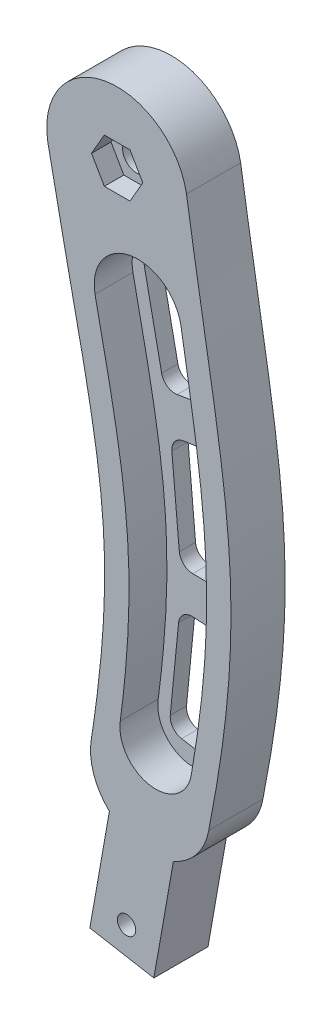
from build123d import *

# Parameters (mm, degrees)
SKETCH1_R           = 2.6
BOSS_EXTRUDE1_DEPTH = 10
SKETCH2_R           = 1.7
BOSS_EXTRUDE2_DEPTH = 10
CUT_EXTRUDE1_DEPTH  = 3.61
CUT_EXTRUDE2_DEPTH  = 7.01


with BuildPart() as part:
    # Sketch1 → Boss-Extrude1 (new body)
    with BuildSketch(Plane.XY.offset(348)):
        with BuildLine():
            ThreePointArc((295.244800935, 76.37840131), (304.167556264, 63.635386072), (316.910571501, 72.558141401))
            add(Edge.make_bspline(
                [(316.910571501, 72.558141401), (317.993077182, 78.060080938), (319.436691833, 86.419493367), (320.644104939, 97.746663028), (321.086020795, 106.446056452), (320.974468629, 115.188631518), (320.331239752, 123.834659135), (319.294204188, 132.281931409), (318.037316746, 140.511779077), (316.695476199, 148.568110679), (314.90656957, 159.124453911), (313.612933772, 167.009808068), (312.802500789, 172.25742631)],
                knots=[0, 0, 0, 0, 0.167265195, 0.252809118, 0.339604775, 0.426899602, 0.513395067, 0.598049027, 0.680668932, 0.761679683, 0.84163696, 1, 1, 1, 1], degree=3))
            ThreePointArc((312.802500789, 172.25742631), (297.74257369, 182.802500789), (287.197499211, 167.74257369))
            add(Edge.make_bspline(
                [(287.197499211, 167.74257369), (288.245214147, 162.428752521), (289.885822364, 154.498518205), (292.118297352, 143.988320878), (293.742742512, 136.235372867), (295.2339085, 128.615976653), (296.473470386, 121.13730858), (297.336811691, 113.762401768), (297.738284398, 106.419106942), (297.668798337, 99.033764721), (297.014800417, 88.987730843), (296.022440082, 81.435185794), (295.244800935, 76.37840131)],
                knots=[0, 0, 0, 0, 0.175721332, 0.26273732, 0.348606728, 0.432722922, 0.514619289, 0.594500878, 0.673506544, 0.753057452, 0.833978021, 1, 1, 1, 1], degree=3))
        make_face()
        with Locations((300, 170)):
            Circle(SKETCH1_R, mode=Mode.SUBTRACT)
        with BuildLine():
            Line((298.037273547, 149.741721474), (301.215790437, 134.288941883))
            ThreePointArc((301.215790437, 134.288941883), (302.249879541, 132.731371076), (304.075121449, 132.326575973))
            Line((304.075121449, 132.326575973), (309.533784891, 133.235441013))
            ThreePointArc((309.533784891, 133.235441013), (311.154644108, 134.244376396), (311.590714405, 136.103133481))
            Line((311.590714405, 136.103133481), (309.035810829, 151.799472168))
            ThreePointArc((309.035810829, 151.799472168), (308.002694304, 153.44538336), (306.102883834, 153.854129723))
            Line((306.102883834, 153.854129723), (300.020607078, 152.701705588))
            ThreePointArc((300.020607078, 152.701705588), (298.409129896, 151.6370167), (298.037273547, 149.741721474))
        make_face(mode=Mode.SUBTRACT)
        with BuildLine():
            Line((303.095062376, 122.802641733), (304.478179716, 107.400584875))
            ThreePointArc((304.478179716, 107.400584875), (305.271665108, 105.787912405), (306.941989082, 105.124324138))
            Line((306.941989082, 105.124324138), (311.308057506, 105.078615953))
            ThreePointArc((311.308057506, 105.078615953), (313.134691512, 105.844024349), (313.831371675, 107.697960312))
            Line((313.831371675, 107.697960312), (313.059492575, 123.830124112))
            ThreePointArc((313.059492575, 123.830124112), (312.159795141, 125.633704646), (310.221794191, 126.187338583))
            Line((310.221794191, 126.187338583), (305.244487527, 125.502939826))
            ThreePointArc((305.244487527, 125.502939826), (303.629055674, 124.583200895), (303.095062376, 122.802641733))
        make_face(mode=Mode.SUBTRACT)
        with BuildLine():
            Line((304.341810749, 95.98294616), (302.807326902, 80.41966071))
            ThreePointArc((302.807326902, 80.41966071), (303.310735667, 78.653947907), (304.884570682, 77.708323546))
            Line((304.884570682, 77.708323546), (308.061893299, 77.17917356))
            ThreePointArc((308.061893299, 77.17917356), (309.951832836, 77.629811361), (310.948319998, 79.297731989))
            Line((310.948319998, 79.297731989), (313.173535223, 95.152129395))
            ThreePointArc((313.173535223, 95.152129395), (312.633934067, 97.081184589), (310.85135927, 97.994886096))
            Line((310.85135927, 97.994886096), (306.983305274, 98.232924126))
            ThreePointArc((306.983305274, 98.232924126), (305.208657773, 97.640818137), (304.341810749, 95.98294616))
        make_face(mode=Mode.SUBTRACT)
    extrude(amount=BOSS_EXTRUDE1_DEPTH)

    # Sketch2 → Boss-Extrude2 (add)
    with BuildSketch(Plane.XY.offset(348)):
        Polygon((294.95939437, 45.965927831), (306.777087406, 43.882149699), (311.465588203, 70.47195903), (299.647895167, 72.555737162), align=None)
        with Locations((301.736481777, 49.84807753)):
            Circle(SKETCH2_R, mode=Mode.SUBTRACT)
    extrude(amount=BOSS_EXTRUDE2_DEPTH)

    # Sketch3 → Cut-Extrude1 (cut)
    with BuildSketch(Plane.XY.offset(354.4)):
        Polygon((304.734272207, 170), (302.367136104, 174.1), (297.632863896, 174.1), (295.265727793, 170), (297.632863896, 165.9), (302.367136104, 165.9), align=None)
    extrude(amount=CUT_EXTRUDE1_DEPTH, mode=Mode.SUBTRACT)

    # Sketch4 → Cut-Extrude2 (cut)
    with BuildSketch(Plane.XY.offset(351)):
        with BuildLine():
            ThreePointArc((300.580931265, 81.888864063), (306.130868326, 74.323372231), (313.696360158, 79.873309293))
            add(Edge.make_bspline(
                [(313.696360158, 79.873309293), (314.375332718, 83.768049726), (315.269853801, 89.655581864), (316.076109947, 97.581166828), (316.452007736, 103.60449348), (316.564187736, 109.663923395), (316.399741723, 115.723723037), (315.97594992, 121.744253087), (315.33821911, 127.695568385), (314.545946492, 133.565929662), (313.36456358, 141.260072259), (312.394961182, 146.988748853), (311.75464163, 150.792263987)],
                knots=[0, 0, 0, 0, 0.166088556, 0.250039022, 0.33458405, 0.419536565, 0.504540949, 0.589152475, 0.673005298, 0.755933527, 0.837970837, 1, 1, 1, 1], degree=3))
            ThreePointArc((311.75464163, 150.792263987), (302.327575287, 157.208623235), (295.911216039, 147.781556891))
            add(Edge.make_bspline(
                [(295.911216039, 147.781556891), (296.697686325, 144.058532846), (297.878134482, 138.498789725), (299.330987648, 131.099349657), (300.305049322, 125.614550146), (301.11991691, 120.165560812), (301.730137241, 114.739277873), (302.103500244, 109.317606169), (302.228444831, 103.882909759), (302.114203921, 98.423103229), (301.672760974, 91.075496307), (301.065579784, 85.565175403), (300.580931265, 81.888864063)],
                knots=[0, 0, 0, 0, 0.171659874, 0.256391336, 0.340162967, 0.422938325, 0.504894902, 0.58642712, 0.668013916, 0.750042635, 0.832709798, 1, 1, 1, 1], degree=3))
        make_face()
    extrude(amount=CUT_EXTRUDE2_DEPTH, mode=Mode.SUBTRACT)


solid = part.part
